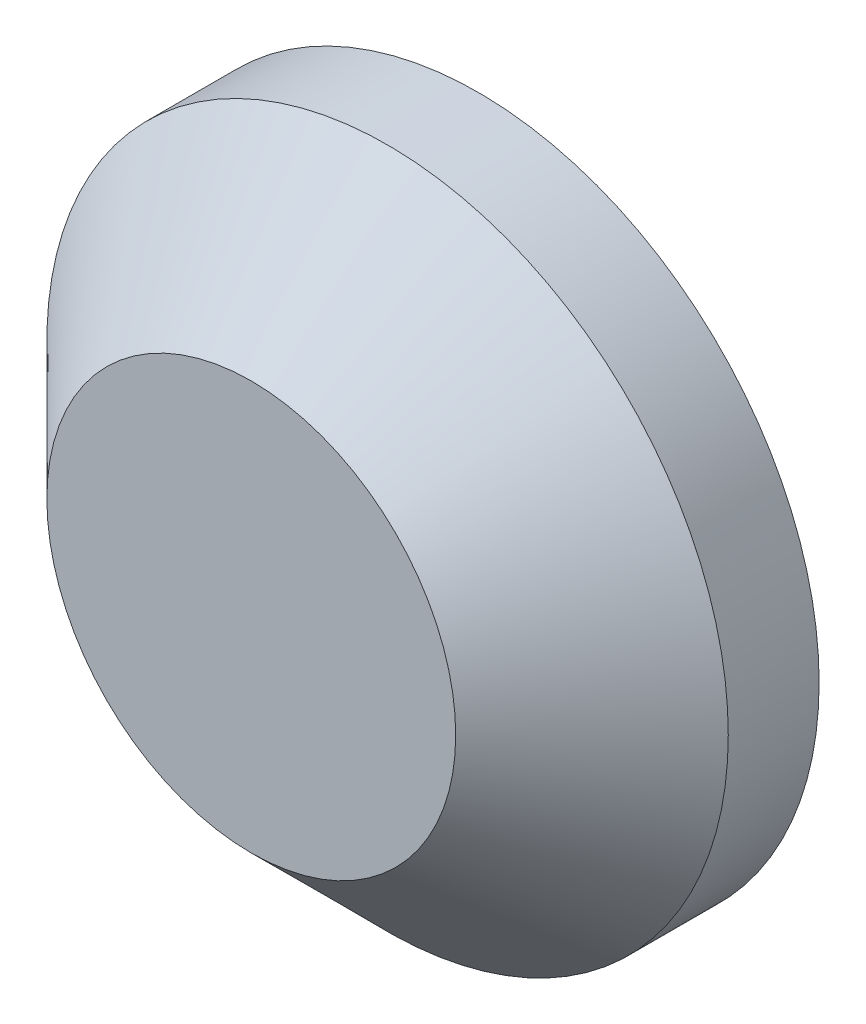
from build123d import *

# Parameters (mm, degrees)
SKETCH1_R           = 7.5
BOSS_EXTRUDE1_DEPTH = 5
CHAMFER1_SIZE       = 3


with BuildPart() as part:
    # Sketch1 → Boss-Extrude1 (new body)
    with BuildSketch(Plane.XY):
        Circle(SKETCH1_R)
    extrude(amount=BOSS_EXTRUDE1_DEPTH)

    # Chamfer1
    chamfer1_edges = [part.edges().sort_by_distance(p)[0] for p in [
        (-7.5, 0, 5),
    ]]
    chamfer(chamfer1_edges, length=CHAMFER1_SIZE)


solid = part.part
